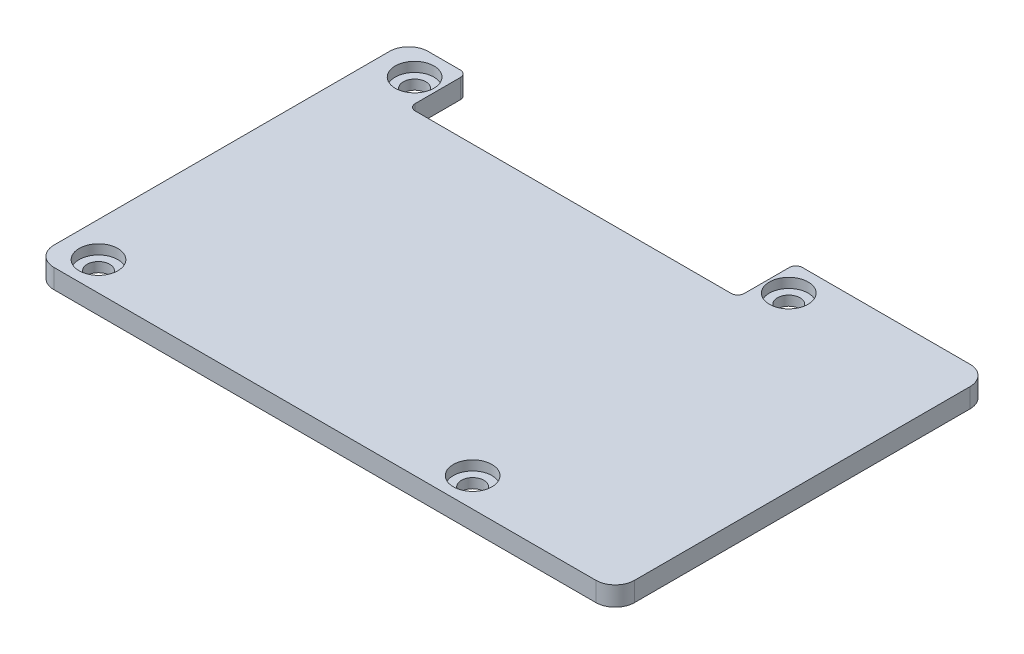
from build123d import *

# Parameters (mm, degrees)
SKETCH1_W           = 90
SKETCH1_H           = 58
BOSS_EXTRUDE1_DEPTH = 3
FILLET1_R           = 3
CUT_EXTRUDE1_REACH  = 55.619
SKETCH2_W           = 51
SKETCH2_H           = 9
FILLET3_R           = 1
CUT_EXTRUDE2_REACH  = 55.619
SKETCH3_R           = 1.75
SKETCH4_R           = 3
CUT_EXTRUDE4_DEPTH  = 1.5


with BuildPart() as part:
    # Sketch1 → Boss-Extrude1 (new body)
    with BuildSketch(Plane(origin=(0, 0, 0), x_dir=(1, 0, 0), z_dir=(0, 1, 0))):
        Rectangle(SKETCH1_W, SKETCH1_H)
    extrude(amount=BOSS_EXTRUDE1_DEPTH)

    # Fillet1
    fillet1_edges = [part.edges().sort_by_distance(p)[0] for p in [
        (-45, 1.5, -29),
        (45, 1.5, -29),
        (45, 1.5, 29),
        (-45, 1.5, 29),
    ]]
    fillet(fillet1_edges, radius=FILLET1_R)

    # Sketch2 → Cut-Extrude1 (cut, up to next)
    with BuildSketch(Plane(origin=(0, 3, 0), x_dir=(1, 0, 0), z_dir=(0, 1, 0)), mode=Mode.PRIVATE) as cut_extrude1_sk1:
        with Locations((-10.5, 24.5)):
            Rectangle(SKETCH2_W, SKETCH2_H)
    cut_extrude1_tool1 = extrude(cut_extrude1_sk1.sketch, amount=-CUT_EXTRUDE1_REACH, mode=Mode.PRIVATE) & part.part
    add(cut_extrude1_tool1.solids().sort_by_distance((-10.5, 3, -24.5))[0], mode=Mode.SUBTRACT)

    # Fillet3
    fillet3_edges = [part.edges().sort_by_distance(p)[0] for p in [
        (-36, 1.5, -20),
        (-36, 1.5, -29),
        (15, 1.5, -29),
        (15, 1.5, -20),
    ]]
    fillet(fillet3_edges, radius=FILLET3_R)

    # Sketch3 → Cut-Extrude2 (cut, up to next)
    with BuildSketch(Plane(origin=(0, 3, 0), x_dir=(1, 0, 0), z_dir=(0, 1, 0)), mode=Mode.PRIVATE) as cut_extrude2_sk1:
        with Locations(Location((-39.6, 24.5, 0), (0, 0, 270))):
            Circle(SKETCH3_R)
    cut_extrude2_tool1 = extrude(cut_extrude2_sk1.sketch, amount=-CUT_EXTRUDE2_REACH, mode=Mode.PRIVATE) & part.part
    # Sketch3 → Cut-Extrude2 (cut, up to next)
    with BuildSketch(Plane(origin=(0, 3, 0), x_dir=(1, 0, 0), z_dir=(0, 1, 0)), mode=Mode.PRIVATE) as cut_extrude2_sk2:
        with Locations(Location((18.4, 24.5, 0), (0, 0, 270))):
            Circle(SKETCH3_R)
    cut_extrude2_tool2 = extrude(cut_extrude2_sk2.sketch, amount=-CUT_EXTRUDE2_REACH, mode=Mode.PRIVATE) & part.part
    cut_extrude2_1 = cut_extrude2_tool1.solids().sort_by_distance((-39.6, 3, -24.5))[0]
    add(cut_extrude2_1, mode=Mode.SUBTRACT)
    cut_extrude2_2 = cut_extrude2_tool2.solids().sort_by_distance((18.4, 3, -24.5))[0]
    add(cut_extrude2_2, mode=Mode.SUBTRACT)
    cut_extrude2 = cut_extrude2_1 + cut_extrude2_2  # Cut-Extrude2 as one shape, for the pattern or mirror that repeats it

    # Mirror1: Cut-Extrude2 across plane
    add(cut_extrude2.mirror(Plane.XY), mode=Mode.SUBTRACT)

    # Sketch4 → Cut-Extrude4 (cut)
    with BuildSketch(Plane(origin=(0, 3, 0), x_dir=(1, 0, 0), z_dir=(0, 1, 0))):
        with Locations(Location((-39.6, 24.5, 0), (0, 0, 270))):
            Circle(SKETCH4_R)
        with Locations(Location((18.4, 24.5, 0), (0, 0, 270))):
            Circle(SKETCH4_R)
    cut_extrude4 = extrude(amount=-CUT_EXTRUDE4_DEPTH, mode=Mode.SUBTRACT)

    # Mirror2: Cut-Extrude4 across plane
    add(cut_extrude4.mirror(Plane.XY), mode=Mode.SUBTRACT)


solid = part.part
